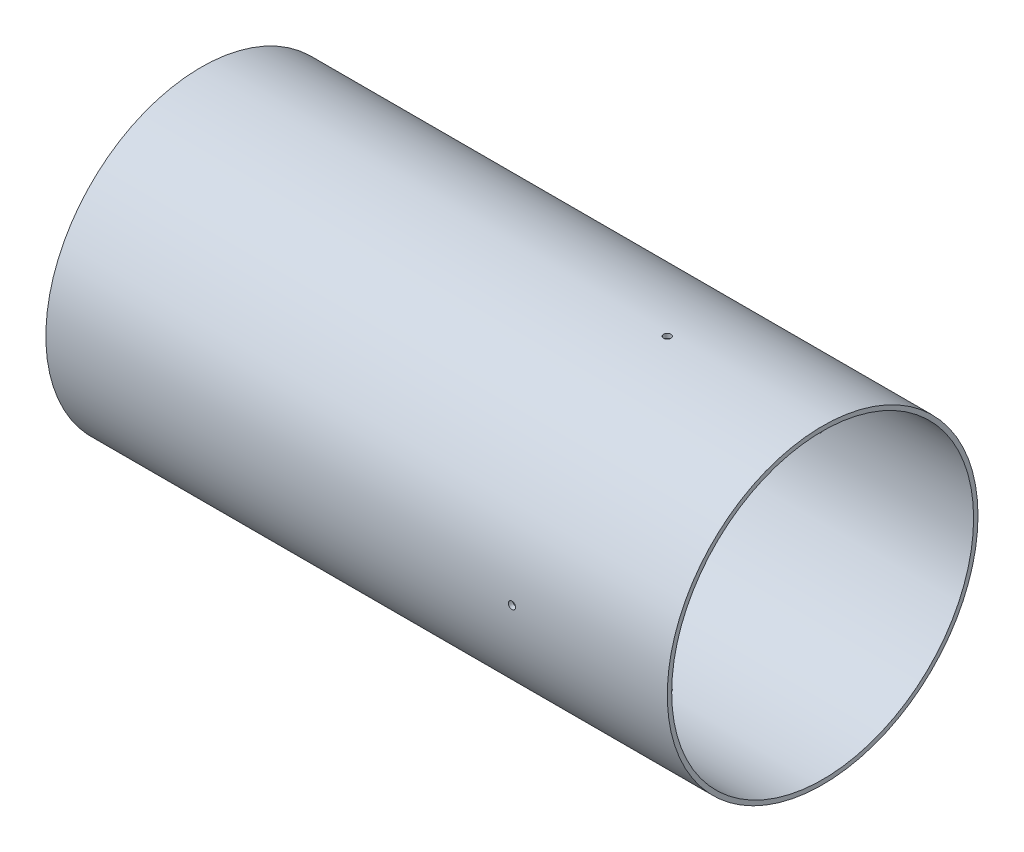
from build123d import *

# Parameters (mm, degrees)
SKETCH1_R               = 76.2
SKETCH1_R_2             = 74.041
BOSS_EXTRUDE1_DEPTH     = 304.8
CUT_EXTRUDE1_REACH      = 325.289
CUT_EXTRUDE1_END_RADIUS = 76.2
SKETCH2_R               = 1.7859375
CIRPATTERN1_COUNT       = 4


with BuildPart() as part:
    # Sketch1 → Boss-Extrude1 (new body)
    with BuildSketch(Plane(origin=(0, 0, 0), x_dir=(0, 0, -1), z_dir=(1, 0, 0))):
        with Locations(Location((0, 0, 0), (0, 0, 180))):
            Circle(SKETCH1_R)
        with Locations(Location((0, 0, 0), (0, 0, 180))):
            Circle(SKETCH1_R_2, mode=Mode.SUBTRACT)
    extrude(amount=BOSS_EXTRUDE1_DEPTH)

    # Cut-Extrude1: up to this cylinder (the profile starts inside it)
    cut_extrude1_end = Plane(origin=(228.6, 0, 0), z_dir=(-1, 0, 0)) * Cylinder(CUT_EXTRUDE1_END_RADIUS, 803.978, mode=Mode.PRIVATE)
    # Sketch2 → Cut-Extrude1 (cut, up to the surface)
    with BuildSketch(Plane.XY, mode=Mode.PRIVATE) as cut_extrude1_sk1:
        with Locations((228.6, 0)):
            Circle(SKETCH2_R)
    cut_extrude1_tool1 = extrude(cut_extrude1_sk1.sketch, amount=-CUT_EXTRUDE1_REACH, mode=Mode.PRIVATE) & cut_extrude1_end
    cut_extrude1 = cut_extrude1_tool1.solids().sort_by_distance((228.6, 0, 0))[0]
    add(cut_extrude1, mode=Mode.SUBTRACT)

    # CirPattern1: Cut-Extrude1 ×4 about axis
    cirpattern1_axis = Axis((0, 0, 0), (1, 0, 0))
    for i in range(1, CIRPATTERN1_COUNT):
        add(cut_extrude1.rotate(cirpattern1_axis, i * 360 / CIRPATTERN1_COUNT), mode=Mode.SUBTRACT)


solid = part.part
